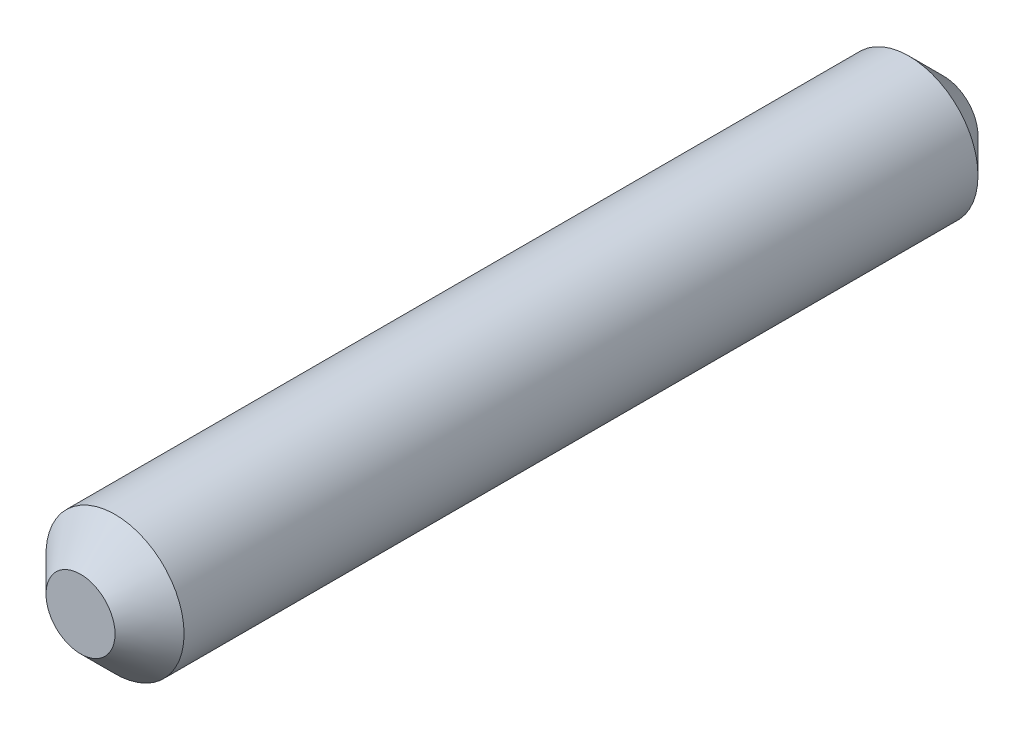
from build123d import *

# Parameters (mm, degrees)
SKETCH1_R           = 2
BOSS_EXTRUDE1_DEPTH = 25
CHAMFER1_SIZE       = 1


with BuildPart() as part:
    # Sketch1 → Boss-Extrude1 (new body)
    with BuildSketch(Plane.XY):
        Circle(SKETCH1_R)
    extrude(amount=BOSS_EXTRUDE1_DEPTH)

    # Chamfer1
    chamfer1_edges = [part.edges().sort_by_distance(p)[0] for p in [
        (-2, 0, 0),
        (-2, 0, 25),
    ]]
    chamfer(chamfer1_edges, length=CHAMFER1_SIZE)


solid = part.part
